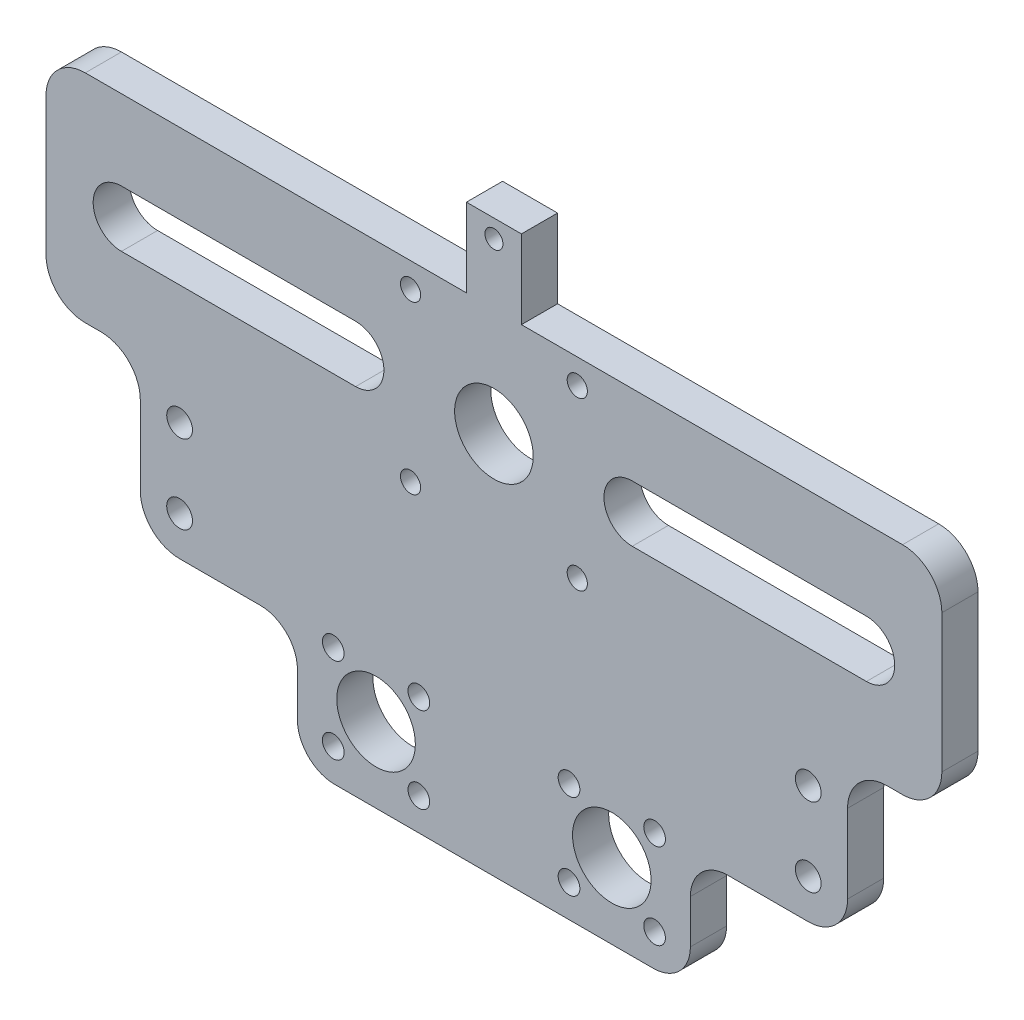
from build123d import *

# Parameters (mm, degrees)
SKETCH1_W           = 144.78
SKETCH1_H           = 34.9885
BOSS_EXTRUDE1_DEPTH = 2.921
SKETCH2_R           = 6.35
SKETCH2_R_2         = 1.63195
CUT_EXTRUDE1_DEPTH  = 75.702676305
FILLET1_R           = 6.35
SKETCH3_W           = 114.3
SKETCH3_H           = 25.4
BOSS_EXTRUDE2_DEPTH = 5.842
FILLET2_R           = 6.35
SKETCH5_R           = 2.0828
CUT_EXTRUDE3_DEPTH  = 85.346652258
SKETCH6_W           = 8.89
SKETCH6_H           = 12.7
SKETCH6_R           = 1.4605
BOSS_EXTRUDE3_DEPTH = 5.842
SKETCH4_W           = 63.5
SKETCH4_H           = 19.05
BOSS_EXTRUDE4_DEPTH = 5.842
SKETCH7_R           = 6.35
CUT_EXTRUDE4_DEPTH  = 96.454340771
CIRPATTERN1_COUNT   = 4
FILLET3_R           = 6


with BuildPart() as part:
    # Sketch1 → Boss-Extrude1 (new, symmetric)
    with BuildSketch(Plane.XY):
        Rectangle(SKETCH1_W, SKETCH1_H)
        with BuildLine():
            Line((22.352, 4.572), (60.198, 4.572))
            ThreePointArc((60.198, 4.572), (64.77, 0), (60.198, -4.572))
            Line((60.198, -4.572), (22.352, -4.572))
            ThreePointArc((22.352, -4.572), (17.78, 0), (22.352, 4.572))
        make_face(mode=Mode.SUBTRACT)
        with BuildLine():
            Line((-22.352, 4.572), (-60.198, 4.572))
            ThreePointArc((-60.198, 4.572), (-64.77, 0), (-60.198, -4.572))
            Line((-60.198, -4.572), (-22.352, -4.572))
            ThreePointArc((-22.352, -4.572), (-17.78, 0), (-22.352, 4.572))
        make_face(mode=Mode.SUBTRACT)
    extrude(amount=BOSS_EXTRUDE1_DEPTH, both=True)

    # Sketch2 → Cut-Extrude1 (cut, through all)
    with BuildSketch(Plane.XY.offset(2.921)):
        Circle(SKETCH2_R)
        with Locations((13.470384182, -13.470384182)):
            Circle(SKETCH2_R_2)
        with Locations((-13.470384182, -13.470384182)):
            Circle(SKETCH2_R_2)
        with Locations((-13.470384182, 13.470384182)):
            Circle(SKETCH2_R_2)
        with Locations((13.470384182, 13.470384182)):
            Circle(SKETCH2_R_2)
    extrude(amount=-CUT_EXTRUDE1_DEPTH, mode=Mode.SUBTRACT)

    # Fillet1
    fillet1_edges = [part.edges().sort_by_distance(p)[0] for p in [
        (-72.39, 17.49425, 0),
        (72.39, 17.49425, 0),
        (72.39, -17.49425, 0),
        (-72.39, -17.49425, 0),
    ]]
    fillet(fillet1_edges, radius=FILLET1_R)

    # Sketch3 → Boss-Extrude2 (add)
    with BuildSketch(Plane.XY.offset(2.921)):
        with Locations((0, -30.19425)):
            Rectangle(SKETCH3_W, SKETCH3_H)
    extrude(amount=-BOSS_EXTRUDE2_DEPTH)

    # Fillet2
    fillet2_edges = [part.edges().sort_by_distance(p)[0] for p in [
        (-57.15, -42.89425, 0),
        (-57.15, -17.49425, 0),
        (57.15, -17.49425, 0),
        (57.15, -42.89425, 0),
    ]]
    fillet(fillet2_edges, radius=FILLET2_R)

    # Sketch5 → Cut-Extrude3 (cut, through all)
    with BuildSketch(Plane(origin=(0, 0, -2.921), x_dir=(-1, 0, 0), z_dir=(0, 0, -1))):
        with Locations((-50.8, -36.54425)):
            Circle(SKETCH5_R)
        with Locations((50.8, -36.54425)):
            Circle(SKETCH5_R)
        with Locations((50.8, -23.84425)):
            Circle(SKETCH5_R)
        with Locations((-50.8, -23.84425)):
            Circle(SKETCH5_R)
    extrude(amount=-CUT_EXTRUDE3_DEPTH, mode=Mode.SUBTRACT)

    # Sketch6 → Boss-Extrude3 (add)
    with BuildSketch(Plane(origin=(0, 0, -2.921), x_dir=(-1, 0, 0), z_dir=(0, 0, -1))):
        with Locations((0, 23.84425)):
            Rectangle(SKETCH6_W, SKETCH6_H)
        with Locations((0, 27.27325)):
            Circle(SKETCH6_R, mode=Mode.SUBTRACT)
    extrude(amount=-BOSS_EXTRUDE3_DEPTH)

    # Sketch4 → Boss-Extrude4 (add)
    with BuildSketch(Plane(origin=(0, 0, -2.921), x_dir=(-1, 0, 0), z_dir=(0, 0, -1))):
        with Locations((0, -52.41925)):
            Rectangle(SKETCH4_W, SKETCH4_H)
    extrude(amount=-BOSS_EXTRUDE4_DEPTH)

    # Sketch7 → Cut-Extrude4 (cut, through all)
    with BuildSketch(Plane(origin=(0, 0, -2.921), x_dir=(-1, 0, 0), z_dir=(0, 0, -1))):
        with Locations((-19.05, -49.809047213)):
            Circle(SKETCH7_R)
    cut_extrude4 = extrude(amount=-CUT_EXTRUDE4_DEPTH, mode=Mode.SUBTRACT)

    # Sketch9 → #6 Clearance Hole1 (revolve, cut)
    with BuildSketch(Plane(origin=(25.964797213, -42.89425, -2.921), x_dir=(0, 1, 0), z_dir=(1, 0, 0))):
        Polygon((0, 0), (0, 10.451068321), (1.7526, 9.398), (1.7526, 0), align=None)
    f_6_clearance_hole1 = revolve(axis=Axis((25.964797213, -42.89425, -9.271), (0, 0, 1)), mode=Mode.SUBTRACT)

    # CirPattern1: #6 Clearance Hole1 ×4 about axis
    cirpattern1_axis = Axis((19.05, -49.809047213, 0), (0, 0, 1))
    for i in range(1, CIRPATTERN1_COUNT):
        add(f_6_clearance_hole1.rotate(cirpattern1_axis, i * 360 / CIRPATTERN1_COUNT), mode=Mode.SUBTRACT)

    # Mirror1: Cut-Extrude4, #6 Clearance Hole1 across plane
    add(cut_extrude4.mirror(Plane.ZY), mode=Mode.SUBTRACT)
    add(f_6_clearance_hole1.mirror(Plane.ZY), mode=Mode.SUBTRACT)

    # Mirror1 copy 1 sketch → Mirror1 copy 1 (revolve, cut)
    with BuildSketch(Plane(origin=(-12.135202787, -42.89425, -2.921), x_dir=(1, 0, 0), z_dir=(0, 1, 0))):
        Polygon((0, 0), (0, -10.451068321), (1.7526, -9.398), (1.7526, 0), align=None)
    revolve(axis=Axis((-12.135202787, -42.89425, -9.271), (0, 0, -1)), mode=Mode.SUBTRACT)

    # Mirror1 copy 2 sketch → Mirror1 copy 2 (revolve, cut)
    with BuildSketch(Plane(origin=(-12.135202787, -56.723844426, -2.921), x_dir=(0, -1, 0), z_dir=(1, 0, 0))):
        Polygon((0, 0), (0, -10.451068321), (1.7526, -9.398), (1.7526, 0), align=None)
    revolve(axis=Axis((-12.135202787, -56.723844426, -9.271), (0, 0, -1)), mode=Mode.SUBTRACT)

    # Mirror1 copy 3 sketch → Mirror1 copy 3 (revolve, cut)
    with BuildSketch(Plane(origin=(-25.964797213, -56.723844426, -2.921), x_dir=(-1, 0, 0), z_dir=(0, -1, 0))):
        Polygon((0, 0), (0, -10.451068321), (1.7526, -9.398), (1.7526, 0), align=None)
    revolve(axis=Axis((-25.964797213, -56.723844426, -9.271), (0, 0, -1)), mode=Mode.SUBTRACT)

    # Fillet3
    fillet3_edges = [part.edges().sort_by_distance(p)[0] for p in [
        (31.75, -42.89425, 0),
        (31.75, -61.94425, 0),
        (-31.75, -61.94425, 0),
        (-31.75, -42.89425, 0),
    ]]
    fillet(fillet3_edges, radius=FILLET3_R)


solid = part.part
